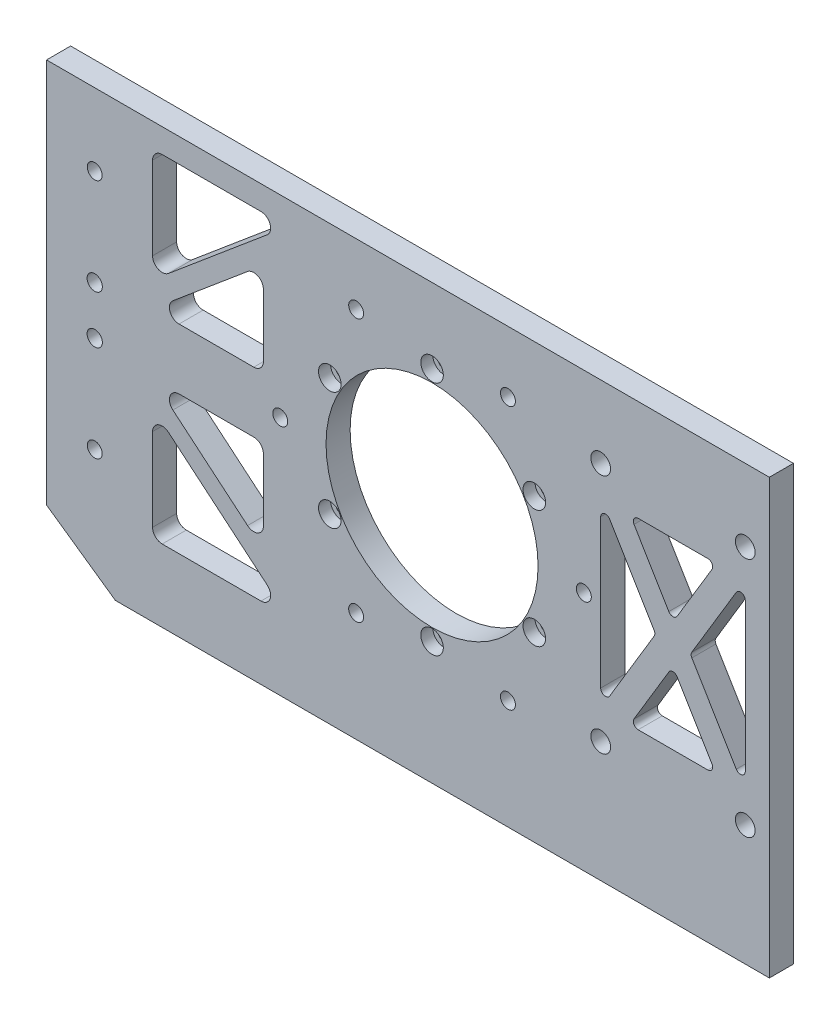
from build123d import *

# Parameters (mm, degrees)
SKETCH_1_W             = 150
SKETCH_1_H             = 80
SKETCH_1_R             = 1.3
SKETCH_1_R_2           = 22
EXTRUDE_1_DEPTH        = 5
SKETCH_2_R             = 2.34
CUT_EXTRUDE_1_DEPTH    = 2.5
SKETCH_3_R             = 1.55
SKETCH_3_R_2           = 1.582849294
CUT_EXTRUDE_3_DEPTH    = 12.5
CUT_EXTRUDE_5_DEPTH    = 8
FILLET_3_R             = 2
FILLET_3_OF_MIRROR_2_R = 2
EXTRUDE_4_DEPTH        = 5
FILLET_5_R             = 5
SKETCH_11_R            = 1.55
CUT_EXTRUDE_7_DEPTH    = 25
SKETCH_12_R            = 2.05
CUT_EXTRUDE_8_DEPTH    = 10
CUT_EXTRUDE_9_DEPTH    = 10
FILLET_6_R             = 1
EXTRUDE_5_DEPTH        = 5
CUT_EXTRUDE_START      = -10
CUT_EXTRUDE_10_DEPTH   = 10


with BuildPart() as part:
    # 草图1 → 凸台-拉伸1 (new body)
    with BuildSketch(Plane.XY):
        with Locations((-5, 0)):
            Rectangle(SKETCH_1_W, SKETCH_1_H)
        with Locations((0, -24.5)):
            Circle(SKETCH_1_R, mode=Mode.SUBTRACT)
        with Locations((-21.217622393, -12.25)):
            Circle(SKETCH_1_R, mode=Mode.SUBTRACT)
        with Locations((-21.217622393, 12.25)):
            Circle(SKETCH_1_R, mode=Mode.SUBTRACT)
        Circle(SKETCH_1_R_2, mode=Mode.SUBTRACT)
        with Locations((0, 24.5)):
            Circle(SKETCH_1_R, mode=Mode.SUBTRACT)
        with Locations((21.217622393, 12.25)):
            Circle(SKETCH_1_R, mode=Mode.SUBTRACT)
        with Locations((21.217622393, -12.25)):
            Circle(SKETCH_1_R, mode=Mode.SUBTRACT)
    extrude(amount=EXTRUDE_1_DEPTH)

    # 草图2 → 切除-拉伸1 (cut)
    with BuildSketch(Plane.XY.offset(5)):
        with Locations((-21.217622393, 12.25)):
            Circle(SKETCH_2_R)
        with Locations((0, 24.5)):
            Circle(SKETCH_2_R)
        with Locations((21.217622393, 12.25)):
            Circle(SKETCH_2_R)
        with Locations((21.217622393, -12.25)):
            Circle(SKETCH_2_R)
        with Locations((0, -24.5)):
            Circle(SKETCH_2_R)
        with Locations((-21.217622393, -12.25)):
            Circle(SKETCH_2_R)
    extrude(amount=-CUT_EXTRUDE_1_DEPTH, mode=Mode.SUBTRACT)

    # 草图3 → 切除-拉伸3 (cut)
    with BuildSketch(Plane.XY.offset(5)):
        with Locations((-70, -25)):
            Circle(SKETCH_3_R)
        with Locations((-70, -5)):
            Circle(SKETCH_3_R_2)
        with Locations((-70, 25)):
            Circle(SKETCH_3_R)
        with Locations((-70, 5)):
            Circle(SKETCH_3_R_2)
    extrude(amount=-CUT_EXTRUDE_3_DEPTH, mode=Mode.SUBTRACT)

    # 草图4 → 切除-拉伸5 (cut)
    with BuildSketch(Plane.XY.offset(5)):
        Polygon((-58, 35), (-30, 35), (-58, 11.505210327), align=None)
        Polygon((-35, 25.582872687), (-58, 6.28358117), (-35, 6.28358117), align=None)
    cut_extrude_5 = extrude(amount=-CUT_EXTRUDE_5_DEPTH, mode=Mode.SUBTRACT)

    # 圆角3
    fillet_3_edges = [part.edges().sort_by_distance(p)[0] for p in [
        (-35, 6.28358117, 2.5),
        (-58, 6.28358117, 2.5),
        (-35, 25.582872687, 2.5),
        (-30, 35, 2.5),
        (-58, 11.505210327, 2.5),
        (-58, 35, 2.5),
    ]]
    fillet(fillet_3_edges, radius=FILLET_3_R)

    # 镜向2: 切除-拉伸5 across plane
    add(cut_extrude_5.mirror(Plane.ZX), mode=Mode.SUBTRACT)

    # 圆角3 of 镜向2
    fillet_3_of_mirror_2_edges = [part.edges().sort_by_distance(p)[0] for p in [
        (-35, -6.28358117, 2.5),
        (-58, -6.28358117, 2.5),
        (-35, -25.582872687, 2.5),
        (-30, -35, 2.5),
        (-58, -11.505210327, 2.5),
        (-58, -35, 2.5),
    ]]
    fillet(fillet_3_of_mirror_2_edges, radius=FILLET_3_OF_MIRROR_2_R)

    # 草图10 → 凸台-拉伸4 (add)
    with BuildSketch(Plane.XY.offset(5)):
        Polygon((-80, -40), (-127.053079228, -7.053079228), (-80, 40), align=None)
    extrude(amount=-EXTRUDE_4_DEPTH)

    # 圆角5
    fillet_5_edges = [part.edges().sort_by_distance(p)[0] for p in [
        (-127.053079228, -7.053079228, 2.5),
    ]]
    fillet(fillet_5_edges, radius=FILLET_5_R)

    # 草图11 → 切除-拉伸7 (cut)
    with BuildSketch(Plane.XY.offset(5)):
        with Locations((-15.75, 27.279800219)):
            Circle(SKETCH_11_R)
        with Locations((15.75, 27.279800219)):
            Circle(SKETCH_11_R)
        with Locations((31.5, 0)):
            Circle(SKETCH_11_R)
        with Locations((15.75, -27.279800219)):
            Circle(SKETCH_11_R)
        with Locations((-15.75, -27.279800219)):
            Circle(SKETCH_11_R)
        with Locations((-31.5, 0)):
            Circle(SKETCH_11_R)
    extrude(amount=-CUT_EXTRUDE_7_DEPTH, mode=Mode.SUBTRACT)

    # 草图12 → 切除-拉伸8 (cut)
    with BuildSketch(Plane.XY.offset(5)):
        with Locations((35, 25)):
            Circle(SKETCH_12_R)
        with Locations((65, 25)):
            Circle(SKETCH_12_R)
        with Locations((65, -25)):
            Circle(SKETCH_12_R)
        with Locations((35, -25)):
            Circle(SKETCH_12_R)
    extrude(amount=-CUT_EXTRUDE_8_DEPTH, mode=Mode.SUBTRACT)

    # 草图13 → 切除-拉伸9 (cut)
    with BuildSketch(Plane.XY.offset(5)):
        Polygon((35, 19), (35, -19), (46.4, 0), align=None)
        Polygon((65, -19), (53.6, 0), (65, 19), align=None)
        Polygon((41, 19), (50, 4), (59, 19), align=None)
        Polygon((50, -4), (59, -19), (41, -19), align=None)
    extrude(amount=-CUT_EXTRUDE_9_DEPTH, mode=Mode.SUBTRACT)

    # 圆角6
    fillet_6_edges = [part.edges().sort_by_distance(p)[0] for p in [
        (41, 19, 2.5),
        (59, 19, 2.5),
        (50, 4, 2.5),
        (65, 19, 2.5),
        (65, -19, 2.5),
        (53.6, 0, 2.5),
        (41, -19, 2.5),
        (50, -4, 2.5),
        (59, -19, 2.5),
        (35, 19, 2.5),
        (46.4, 0, 2.5),
        (35, -19, 2.5),
    ]]
    fillet(fillet_6_edges, radius=FILLET_6_R)

    # 草图14 → 凸台-拉伸5 (add)
    with BuildSketch(Plane.XY.offset(5)):
        Polygon((-80, -40), (-65.718519933, -50), (70, -50), (70, -40), align=None)
    extrude(amount=-EXTRUDE_5_DEPTH)

    # 草图15 → 切除-拉伸10 (cut)
    with BuildSketch(Plane.XY.offset(5).offset(CUT_EXTRUDE_START)):
        with BuildLine():
            Line((-80, 40), (-122.839593994, -2.839593994))
            ThreePointArc((-122.839593994, -2.839593994), (-124.285033579, -6.810906614), (-122.17194227, -10.470888122))
            Line((-122.17194227, -10.470888122), (-80, -40))
            Line((-80, -40), (-80, 0))
            Line((-80, 0), (-80, 40))
        make_face()
    extrude(amount=CUT_EXTRUDE_10_DEPTH, mode=Mode.SUBTRACT)


solid = part.part
